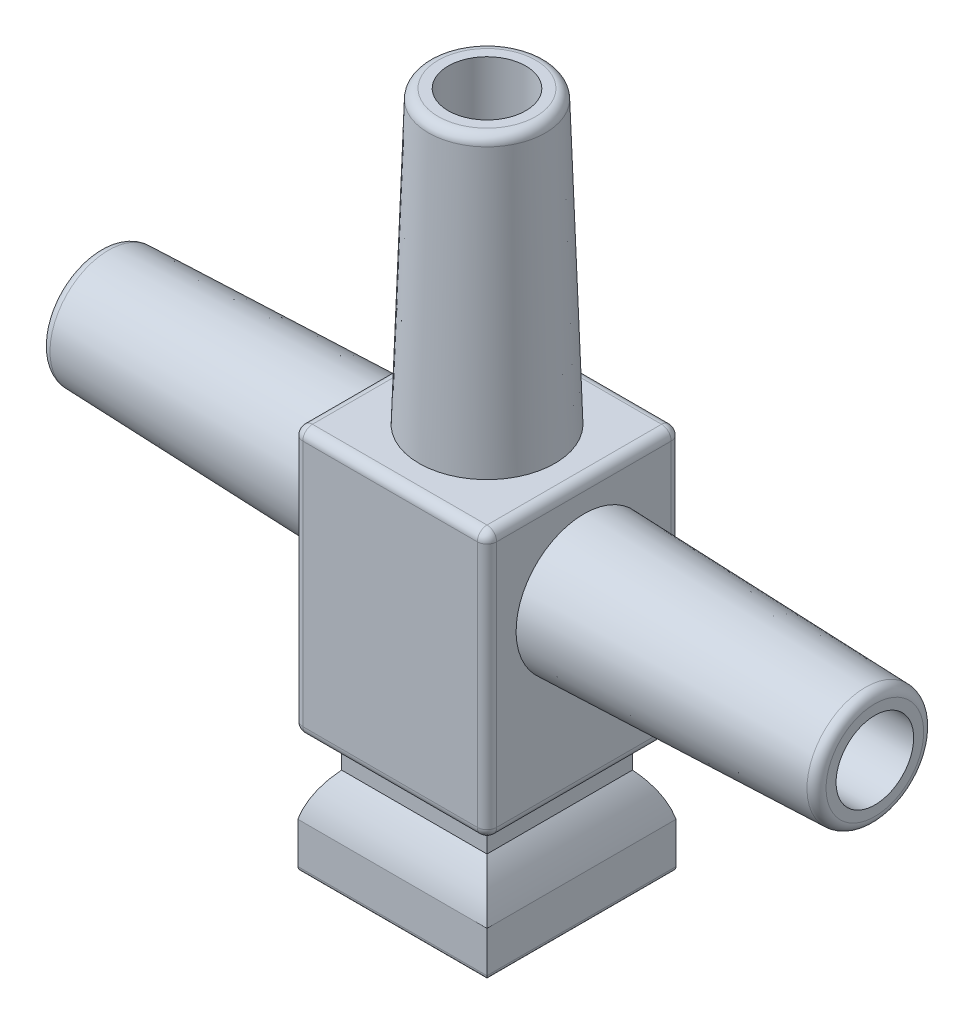
from build123d import *

# Parameters (mm, degrees)
EXTRUDE_1_DEPTH          = 2
EXTRUDE_1_DEPTH_BACK     = 2
SKETCH_1_W               = 4
SKETCH_1_H               = 5.5
EXTRUDE_2_DEPTH          = 2
EXTRUDE_2_DEPTH_BACK     = 2
CUT_EXTRUDE_1_DEPTH      = 2
CUT_EXTRUDE_1_DEPTH_BACK = 2
SKETCH_4_R               = 1.4
SKETCH_5_R               = 1.2
SKETCH_6_R               = 1.4
SKETCH_7_R               = 1.2
SKETCH_8_R               = 0.8
CUT_EXTRUDE_2_DEPTH      = 19.345639944
SKETCH_9_R               = 0.8
CUT_EXTRUDE_3_DEPTH      = 8
FILLET_1_R               = 0.2
FILLET_2_R               = 0.2
FILLET_3_R               = 0.1


with BuildPart() as part:
    # 草图1 → 凸台-拉伸1 (new, two sides: drawn at the far end of the back side and taken through both)
    with BuildSketch(Plane.XY.offset(-EXTRUDE_1_DEPTH_BACK)):
        Rectangle(SKETCH_1_W, SKETCH_1_H)
    extrude(amount=EXTRUDE_1_DEPTH + EXTRUDE_1_DEPTH_BACK)

    # 草图2 → 凸台-拉伸2 (add, two sides: drawn at the far end of the back side and taken through both)
    with BuildSketch(Plane.XY.offset(-EXTRUDE_2_DEPTH_BACK)):
        with BuildLine():
            Line((-1.5, -2.75), (1.5, -2.75))
            Line((1.5, -2.75), (1.5, -3.427124344))
            ThreePointArc((1.5, -3.427124344), (1.780042303, -3.838161527), (1.95, -4.305590279))
            Line((1.95, -4.305590279), (1.95, -5.25))
            Line((1.95, -5.25), (-1.95, -5.25))
            Line((-1.95, -5.25), (-1.95, -4.305590279))
            ThreePointArc((-1.95, -4.305590279), (-1.780042303, -3.838161527), (-1.5, -3.427124344))
            Line((-1.5, -3.427124344), (-1.5, -2.75))
        make_face()
    extrude(amount=EXTRUDE_2_DEPTH + EXTRUDE_2_DEPTH_BACK)

    # 草图3 → 切除-拉伸1 (cut, two sides: drawn at the far end of the back side and taken through both)
    with BuildSketch(Plane(origin=(0, 0, 0), x_dir=(0, 0, -1), z_dir=(1, 0, 0)).offset(-CUT_EXTRUDE_1_DEPTH_BACK)):
        with BuildLine():
            Line((1.5, -2.75), (1.5, -3.427124344))
            ThreePointArc((1.5, -3.427124344), (1.780042303, -3.838161527), (1.95, -4.305590279))
            Line((1.95, -4.305590279), (1.95, -5.25))
            Line((1.95, -5.25), (2, -5.25))
            Line((2, -5.25), (2, -2.75))
            Line((2, -2.75), (1.5, -2.75))
        make_face()
        with BuildLine():
            Line((-2, -5.25), (-1.95, -5.25))
            Line((-1.95, -5.25), (-1.95, -4.305590279))
            ThreePointArc((-1.95, -4.305590279), (-1.780042303, -3.838161527), (-1.5, -3.427124344))
            Line((-1.5, -3.427124344), (-1.5, -2.75))
            Line((-1.5, -2.75), (-2, -2.75))
            Line((-2, -2.75), (-2, -5.25))
        make_face()
    extrude(amount=CUT_EXTRUDE_1_DEPTH + CUT_EXTRUDE_1_DEPTH_BACK, mode=Mode.SUBTRACT)

    # 草图4 → 放样2 section 0
    with BuildSketch(Plane(origin=(2, 0, 0), x_dir=(0, 0, -1), z_dir=(1, 0, 0))):
        with Locations((0, 0.75)):
            Circle(SKETCH_4_R)
    # 草图5 → 放样2 section 1
    with BuildSketch(Plane(origin=(8, 0, 0), x_dir=(0, 0, -1), z_dir=(1, 0, 0))):
        with Locations((0, 0.75)):
            Circle(SKETCH_5_R)
    loft_2 = loft()

    # 镜向1: 放样2 across plane
    add(loft_2.mirror(Plane(origin=(0, 0, 0), x_dir=(0, 0, 1), z_dir=(1, 0, 0))))

    # 草图6 → 放样3 section 0
    with BuildSketch(Plane(origin=(0, 2.75, 0), x_dir=(1, 0, 0), z_dir=(0, 1, 0))):
        Circle(SKETCH_6_R)
    # 草图7 → 放样3 section 1
    with BuildSketch(Plane(origin=(0, 8.75, 0), x_dir=(1, 0, 0), z_dir=(0, 1, 0))):
        Circle(SKETCH_7_R)
    loft()

    # 草图8 → 切除-拉伸2 (cut, through all)
    with BuildSketch(Plane(origin=(8, 0, 0), x_dir=(0, 0, -1), z_dir=(1, 0, 0))):
        with Locations(Location((0, 0.75, 0), (0, 0, 90))):
            Circle(SKETCH_8_R)
    extrude(amount=-CUT_EXTRUDE_2_DEPTH, mode=Mode.SUBTRACT)

    # 草图9 → 切除-拉伸3 (cut)
    with BuildSketch(Plane(origin=(0, 8.75, 0), x_dir=(1, 0, 0), z_dir=(0, 1, 0))):
        with Locations(Location((0, 0, 0), (0, 0, 270))):
            Circle(SKETCH_9_R)
    extrude(amount=-CUT_EXTRUDE_3_DEPTH, mode=Mode.SUBTRACT)

    # 圆角1
    fillet_1_edges = [part.edges().sort_by_distance(p)[0] for p in [
        (0, -2.75, -2),
        (0, 2.75, 2),
        (-2, 0, 2),
        (2, 0, -2),
        (0, -2.75, 2),
        (2, 0, 2),
        (0, 2.75, -2),
        (-2, 0, -2),
        (2, 2.75, 0),
        (2, -2.75, 0),
        (-2, -2.75, 0),
        (-2, 2.75, 0),
    ]]
    fillet(fillet_1_edges, radius=FILLET_1_R)

    # 圆角2
    fillet_2_edges = [part.edges().sort_by_distance(p)[0] for p in [
        (8, 0.75, 1.2),
        (-8, 0.75, 1.2),
        (-1.2, 8.75, 0),
    ]]
    fillet(fillet_2_edges, radius=FILLET_2_R)

    # 圆角3
    fillet_3_edges = [part.edges().sort_by_distance(p)[0] for p in [
        (0, -5.25, 1.95),
        (1.95, -5.25, 0),
        (-1.95, -5.25, 0),
        (0, -5.25, -1.95),
    ]]
    fillet(fillet_3_edges, radius=FILLET_3_R)


solid = part.part
